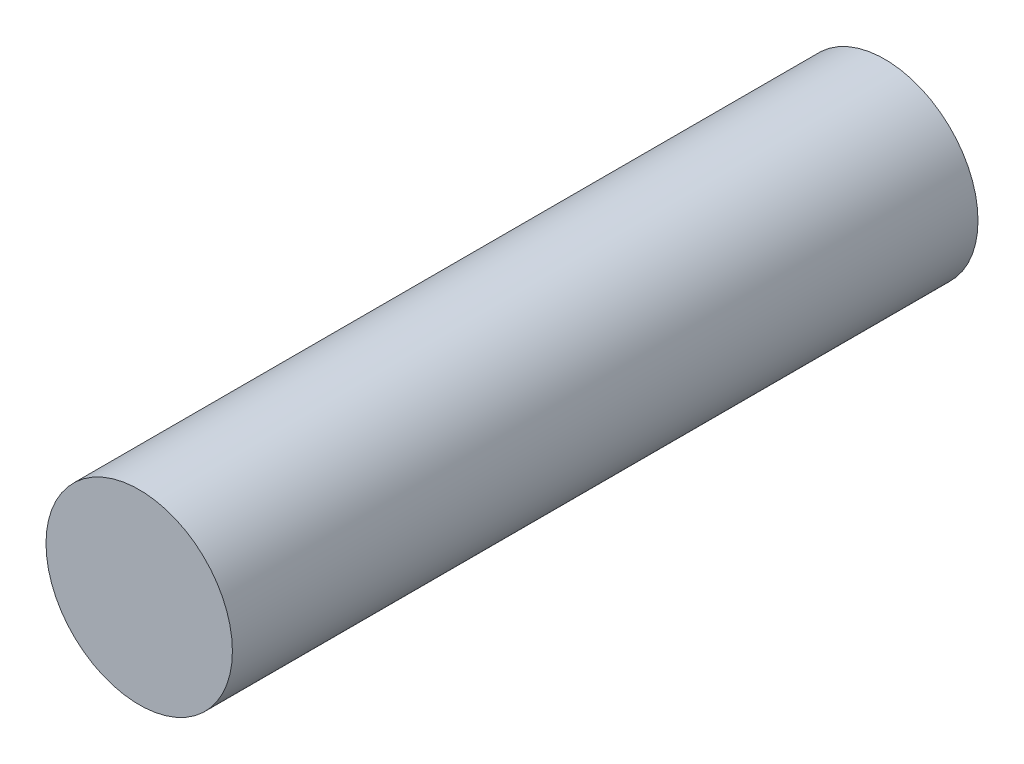
from build123d import *

# Parameters (mm, degrees)
SCHIZZO1_R                   = 3
ESTRUSIONE_ESTRUSIONE1_DEPTH = 24


with BuildPart() as part:
    # Schizzo1 → Estrusione-Estrusione1 (new body)
    with BuildSketch(Plane.XY):
        Circle(SCHIZZO1_R)
    extrude(amount=-ESTRUSIONE_ESTRUSIONE1_DEPTH)


solid = part.part
